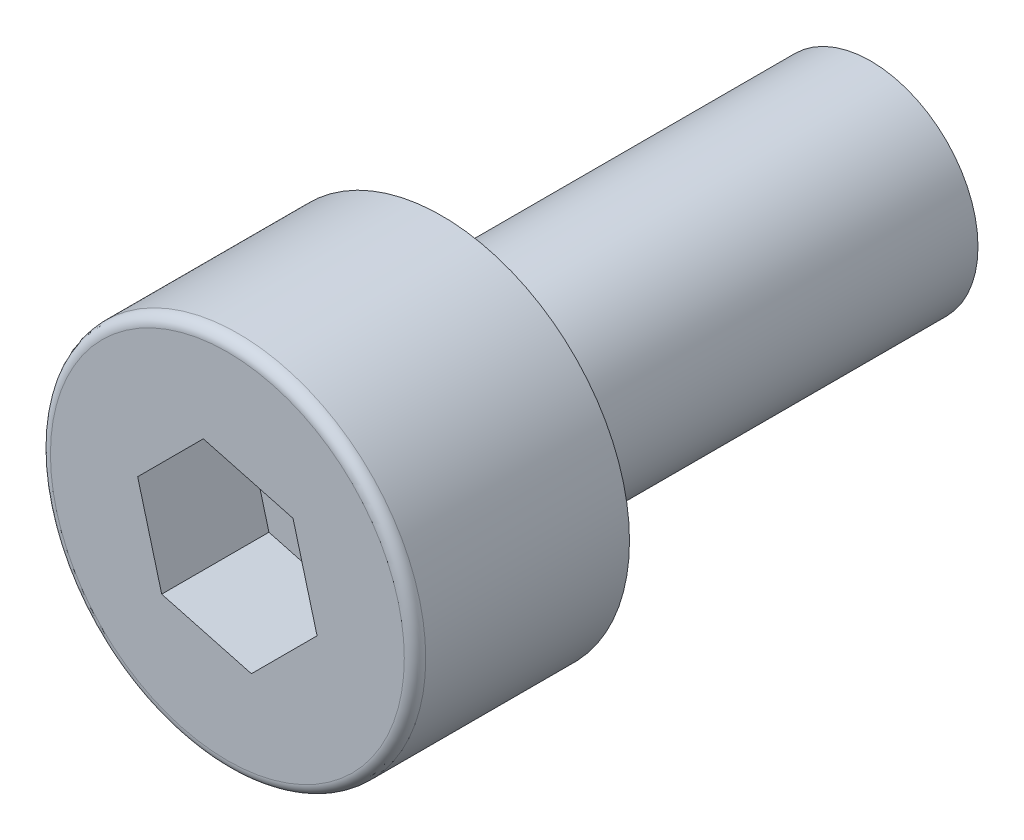
from build123d import *

# Parameters (mm, degrees)
SKETCH_1_R          = 3.5
EXTRUDE_1_DEPTH     = 4
CUT_EXTRUDE_1_DEPTH = 2
SKETCH_3_R          = 2
EXTRUDE_2_DEPTH     = 8
FILLET_1_R          = 0.2


with BuildPart() as part:
    # 草图1 → 凸台-拉伸1 (new body)
    with BuildSketch(Plane.XY):
        Circle(SKETCH_1_R)
    extrude(amount=EXTRUDE_1_DEPTH)

    # 草图2 → 切除-拉伸1 (cut)
    with BuildSketch(Plane.XY.offset(4)):
        Polygon((-1.224744871, -1.224744871), (0.448287736, -1.673032607), (1.673032607, -0.448287736), (1.224744871, 1.224744871), (-0.448287736, 1.673032607), (-1.673032607, 0.448287736), align=None)
    extrude(amount=-CUT_EXTRUDE_1_DEPTH, mode=Mode.SUBTRACT)

    # 草图3 → 凸台-拉伸2 (add)
    with BuildSketch(Plane(origin=(0, 0, 0), x_dir=(-1, 0, 0), z_dir=(0, 0, -1))):
        with Locations(Location((0, 0, 0), (0, 0, 180))):
            Circle(SKETCH_3_R)
    extrude(amount=EXTRUDE_2_DEPTH)

    # 圆角1
    fillet_1_edges = [part.edges().sort_by_distance(p)[0] for p in [
        (-3.5, 0, 4),
    ]]
    fillet(fillet_1_edges, radius=FILLET_1_R)


solid = part.part
